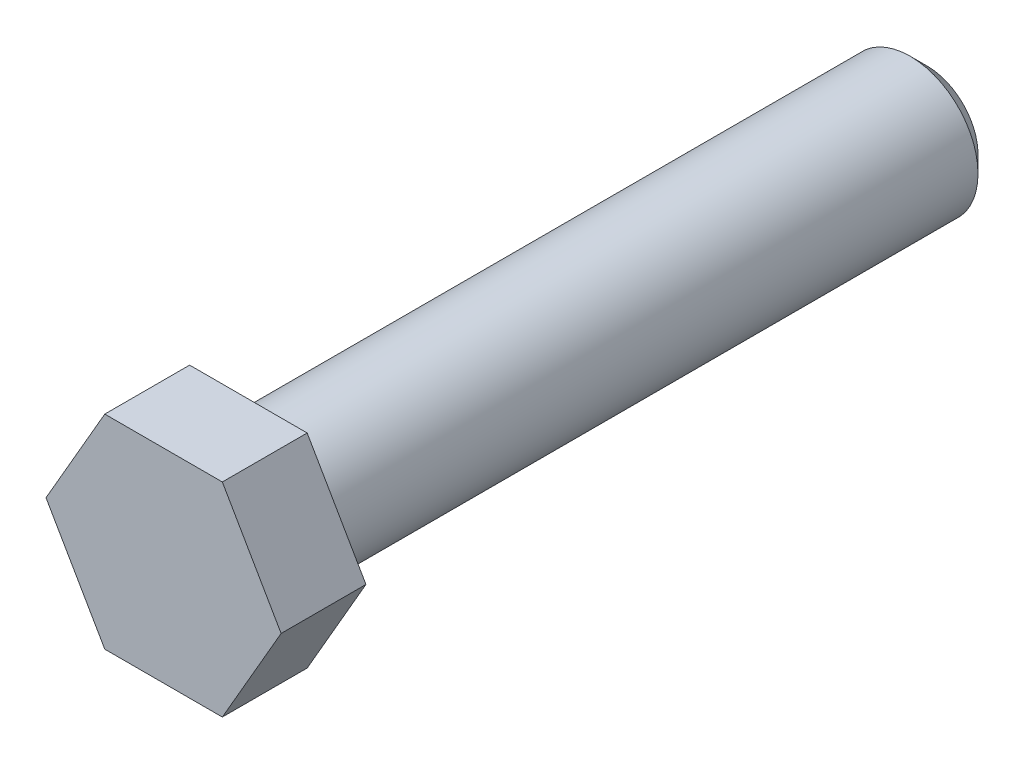
from build123d import *

# Parameters (mm, degrees)
BASE_EXTRUDE_DEPTH  = 7.5
SKETCH3_R           = 6
BOSS_EXTRUDE1_DEPTH = 60
CHAMFER1_SIZE       = 1.5


with BuildPart() as part:
    # Sketch1 → Base-Extrude (new body)
    with BuildSketch(Plane.XY):
        Polygon((-5.196152423, 9), (5.196152423, 9), (10.392304845, 0), (5.196152423, -9), (-5.196152423, -9), (-10.392304845, 0), align=None)
    extrude(amount=BASE_EXTRUDE_DEPTH)

    # Sketch3 → Boss-Extrude1 (add)
    with BuildSketch(Plane(origin=(0, 0, 0), x_dir=(-1, 0, 0), z_dir=(0, 0, -1))):
        with Locations(Location((0, 0, 0), (0, 0, 180))):
            Circle(SKETCH3_R)
    extrude(amount=BOSS_EXTRUDE1_DEPTH)

    # Chamfer1
    chamfer1_edges = [part.edges().sort_by_distance(p)[0] for p in [
        (-6, 0, -60),
    ]]
    chamfer(chamfer1_edges, length=CHAMFER1_SIZE)


solid = part.part
